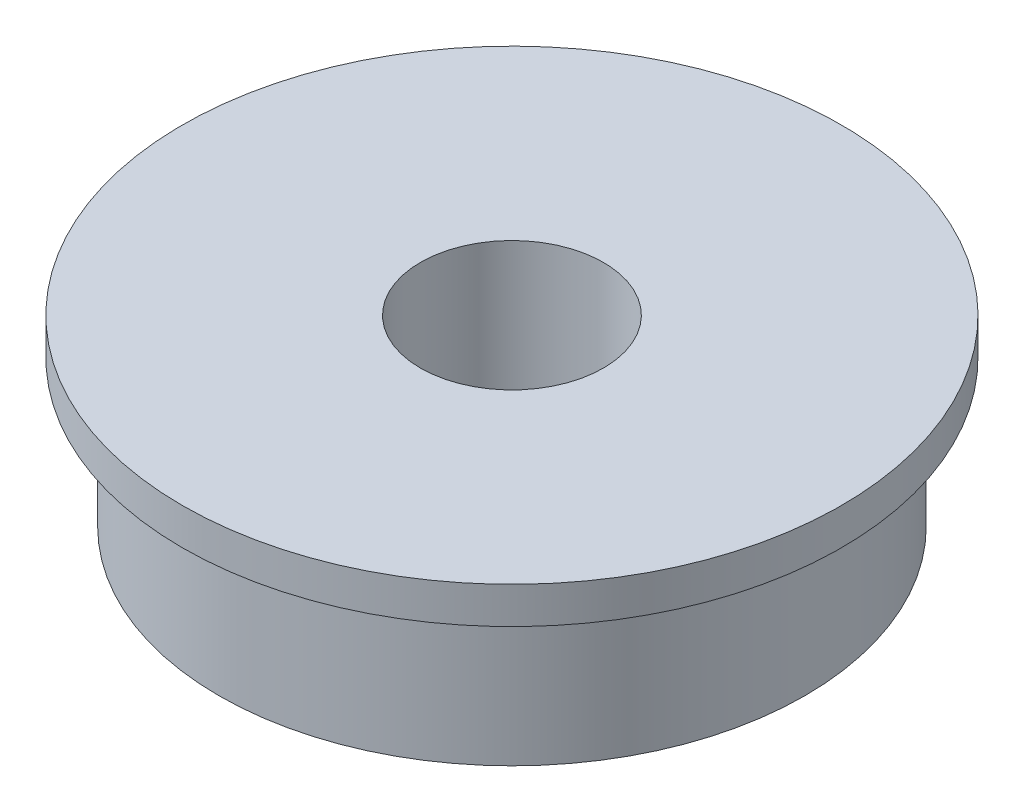
from build123d import *

# Parameters (mm, degrees)
SKETCH1_R           = 8
SKETCH1_R_2         = 2.5
BOSS_EXTRUDE1_DEPTH = 4
SKETCH2_R           = 9
SKETCH2_R_2         = 2.5
BOSS_EXTRUDE2_DEPTH = 1


with BuildPart() as part:
    # Sketch1 → Boss-Extrude1 (new body)
    with BuildSketch(Plane(origin=(0, 0, 0), x_dir=(1, 0, 0), z_dir=(0, 1, 0))):
        with Locations(Location((0, 0, 0), (0, 0, 270))):
            Circle(SKETCH1_R)
        with Locations(Location((0, 0, 0), (0, 0, 270))):
            Circle(SKETCH1_R_2, mode=Mode.SUBTRACT)
    extrude(amount=BOSS_EXTRUDE1_DEPTH)

    # Sketch2 → Boss-Extrude2 (add)
    with BuildSketch(Plane(origin=(0, 4, 0), x_dir=(1, 0, 0), z_dir=(0, 1, 0))):
        with Locations(Location((0, 0, 0), (0, 0, 270))):
            Circle(SKETCH2_R)
        with Locations(Location((0, 0, 0), (0, 0, 270))):
            Circle(SKETCH2_R_2, mode=Mode.SUBTRACT)
    extrude(amount=BOSS_EXTRUDE2_DEPTH)


solid = part.part
